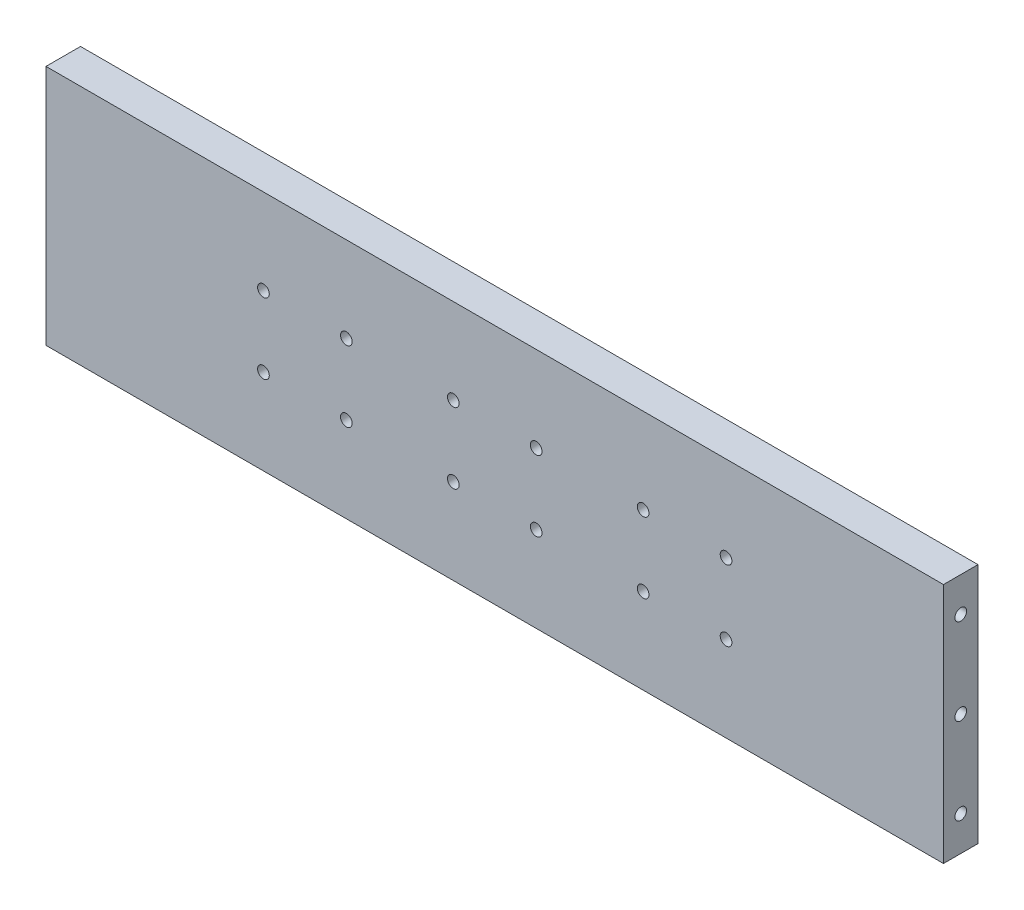
from build123d import *

# Parameters (mm, degrees)
SKETCH1_W           = 330.2
SKETCH1_H           = 88.9
BOSS_EXTRUDE1_DEPTH = 12.7
SKETCH3_R           = 2.1463
CUT_EXTRUDE1_DEPTH  = 38.1
CUT_EXTRUDE2_START  = -38.1
SKETCH5_R           = 2.1463
CUT_EXTRUDE2_DEPTH  = 38.1
SKETCH6_R           = 2.1463
CUT_EXTRUDE3_DEPTH  = 343.193717067


with BuildPart() as part:
    # Sketch1 → Boss-Extrude1 (new body)
    with BuildSketch(Plane.XY):
        with Locations((165.1, 44.45)):
            Rectangle(SKETCH1_W, SKETCH1_H)
    extrude(amount=BOSS_EXTRUDE1_DEPTH)

    # Sketch3 → Cut-Extrude1 (cut)
    with BuildSketch(Plane.ZY):
        with Locations((6.35, 76.2)):
            Circle(SKETCH3_R)
        with Locations((6.35, 12.7)):
            Circle(SKETCH3_R)
        with Locations((6.35, 44.45)):
            Circle(SKETCH3_R)
    extrude(amount=-CUT_EXTRUDE1_DEPTH, mode=Mode.SUBTRACT)

    # Sketch5 → Cut-Extrude2 (cut)
    with BuildSketch(Plane(origin=(330.2, 0, 0), x_dir=(0, 0, -1), z_dir=(1, 0, 0)).offset(CUT_EXTRUDE2_START)):
        with Locations(Location((-6.35, 76.2, 0), (0, 0, 180))):
            Circle(SKETCH5_R)
        with Locations(Location((-6.35, 12.7, 0), (0, 0, 180))):
            Circle(SKETCH5_R)
        with Locations(Location((-6.35, 44.45, 0), (0, 0, 180))):
            Circle(SKETCH5_R)
    extrude(amount=CUT_EXTRUDE2_DEPTH, mode=Mode.SUBTRACT)

    # Sketch6 → Cut-Extrude3 (cut, through all)
    with BuildSketch(Plane(origin=(0, 0, 0), x_dir=(-1, 0, 0), z_dir=(0, 0, -1))):
        with Locations((-250.2, 57.45)):
            Circle(SKETCH6_R)
        with Locations((-219.7, 57.45)):
            Circle(SKETCH6_R)
        with Locations((-219.7, 31.45)):
            Circle(SKETCH6_R)
        with Locations((-250.2, 31.45)):
            Circle(SKETCH6_R)
        with Locations((-180.35, 57.45)):
            Circle(SKETCH6_R)
        with Locations((-149.85, 57.45)):
            Circle(SKETCH6_R)
        with Locations((-149.85, 31.45)):
            Circle(SKETCH6_R)
        with Locations((-180.35, 31.45)):
            Circle(SKETCH6_R)
        with Locations((-110.5, 31.45)):
            Circle(SKETCH6_R)
        with Locations((-110.5, 57.45)):
            Circle(SKETCH6_R)
        with Locations((-80, 57.45)):
            Circle(SKETCH6_R)
        with Locations((-80, 31.45)):
            Circle(SKETCH6_R)
    extrude(amount=-CUT_EXTRUDE3_DEPTH, mode=Mode.SUBTRACT)


solid = part.part
